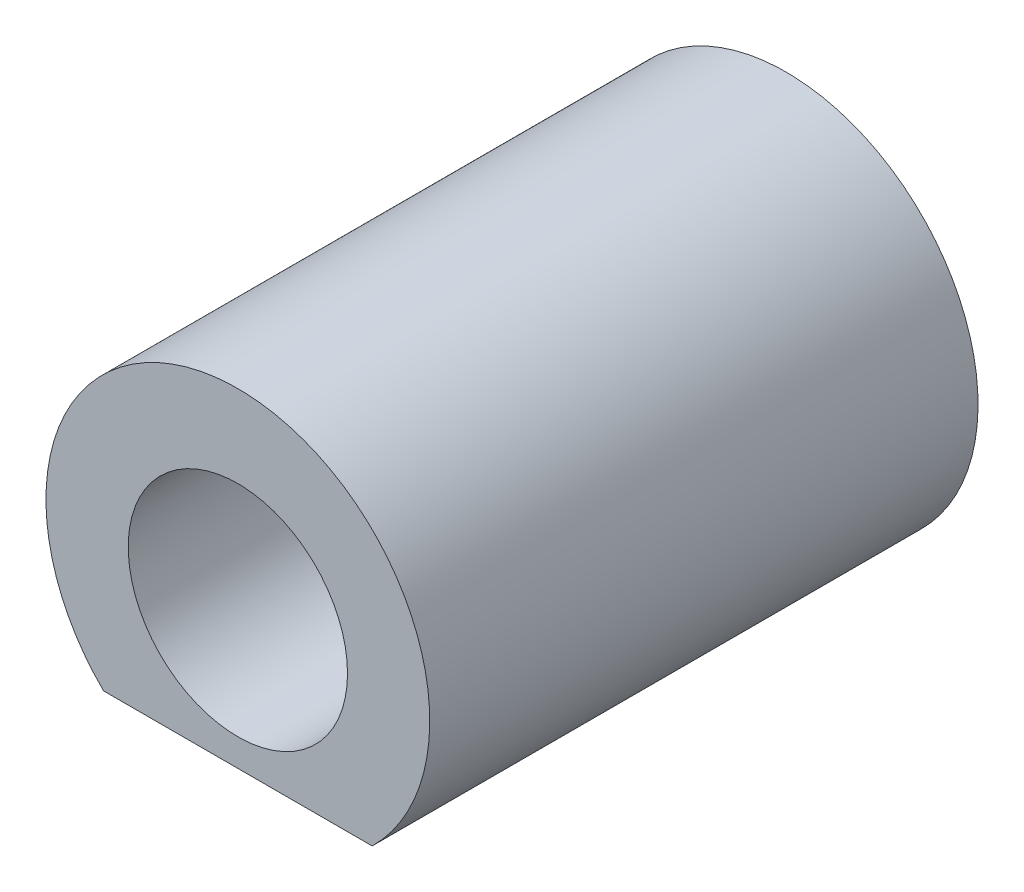
from build123d import *

# Parameters (mm, degrees)
SKETCH1_R           = 4
BOSS_EXTRUDE1_DEPTH = 20


with BuildPart() as part:
    # Sketch1 → Boss-Extrude1 (new body)
    with BuildSketch(Plane.XY):
        with BuildLine():
            Line((4.898979486, -5), (-4.898979486, -5))
            ThreePointArc((-4.898979486, -5), (0, 7), (4.898979486, -5))
        make_face()
        Circle(SKETCH1_R, mode=Mode.SUBTRACT)
    extrude(amount=-BOSS_EXTRUDE1_DEPTH)


solid = part.part
